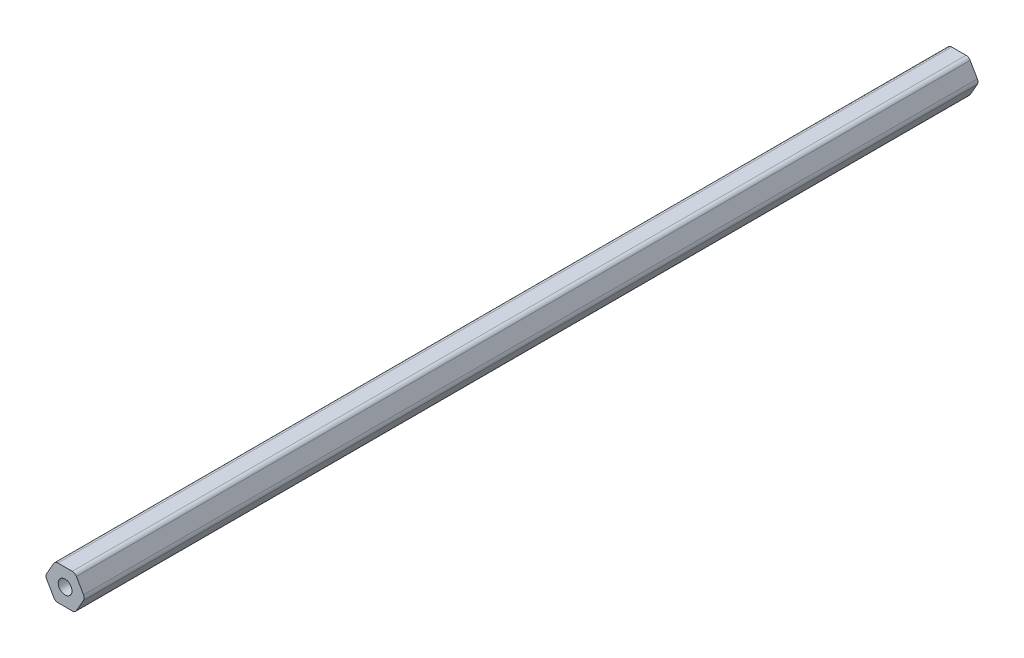
from build123d import *

# Parameters (mm, degrees)
SKETCH1_R           = 2.54
BOSS_EXTRUDE1_DEPTH = 330.2
FILLET1_R           = 1.778


with BuildPart() as part:
    # Sketch1 → Boss-Extrude1 (new body)
    with BuildSketch(Plane.XY):
        Polygon((6.708318766, 2.691127877), (3.042144557, 9.041127877), (-4.290203862, 9.041127877), (-7.956378071, 2.691127877), (-4.290203862, -3.658872123), (3.042144557, -3.658872123), align=None)
        with Locations((-0.624029653, 2.691127877)):
            Circle(SKETCH1_R, mode=Mode.SUBTRACT)
    extrude(amount=BOSS_EXTRUDE1_DEPTH)

    # Fillet1
    fillet1_edges = [part.edges().sort_by_distance(p)[0] for p in [
        (3.042144557, -3.658872123, 165.1),
        (-4.290203862, -3.658872123, 165.1),
        (-7.956378071, 2.691127877, 165.1),
        (-4.290203862, 9.041127877, 165.1),
        (3.042144557, 9.041127877, 165.1),
        (6.708318766, 2.691127877, 165.1),
    ]]
    fillet(fillet1_edges, radius=FILLET1_R)


solid = part.part
